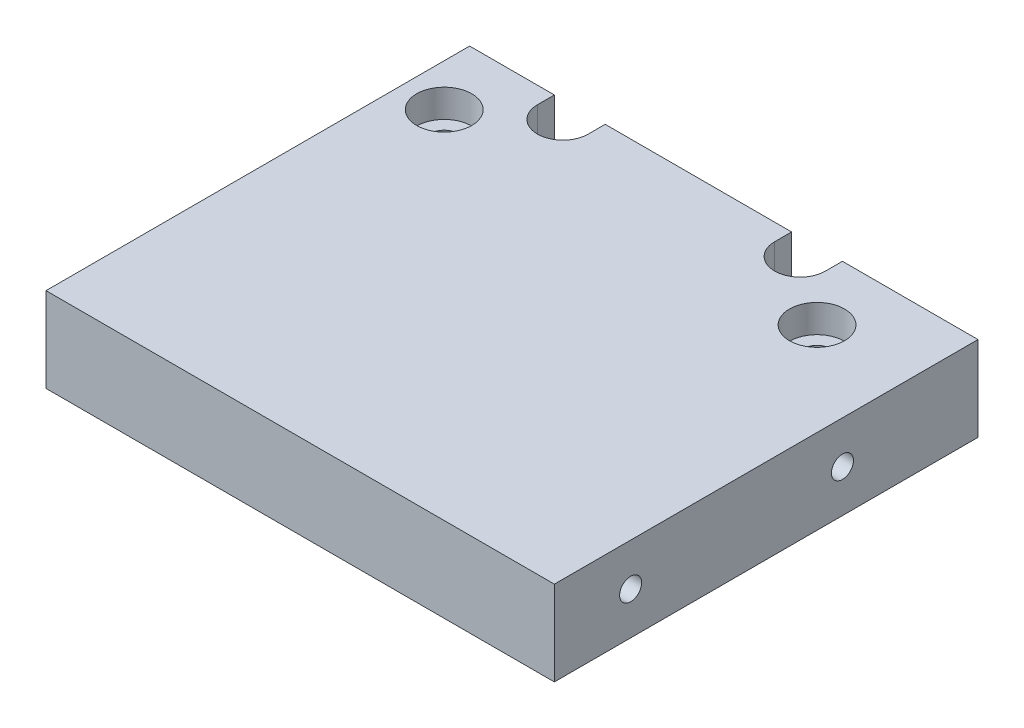
from build123d import *

# Parameters (mm, degrees)
SKETCH1_W                                = 60
SKETCH1_H                                = 50
BOSS_EXTRUDE1_DEPTH                      = 10
CUT_EXTRUDE1_DEPTH                       = 10
BOSS_EXTRUDE2_REACH                      = 80.74
CBORE_FOR_M3_PAN_HEAD_SCREW1_D           = 3.4
CBORE_FOR_M3_PAN_HEAD_SCREW1_CBORE_D     = 6.5
CBORE_FOR_M3_PAN_HEAD_SCREW1_CBORE_DEPTH = 3.3
M3X0_5_TAPPED_HOLE1_D                    = 2.6
M3X0_5_TAPPED_HOLE1_DEPTH                = 9
M3X0_5_TAPPED_HOLE1_TIP                  = 0.781118805
M3X0_5_TAPPED_HOLE2_D                    = 2.6
M3X0_5_TAPPED_HOLE2_DEPTH                = 9
M3X0_5_TAPPED_HOLE2_TIP                  = 0.781118805


with BuildPart() as part:
    # Sketch1 → Boss-Extrude1 (new body)
    with BuildSketch(Plane(origin=(0, 0, 0), x_dir=(1, 0, 0), z_dir=(0, 1, 0))):
        with Locations((30, 25)):
            Rectangle(SKETCH1_W, SKETCH1_H)
    extrude(amount=BOSS_EXTRUDE1_DEPTH)

    # Sketch2 → Cut-Extrude1 (cut)
    with BuildSketch(Plane(origin=(0, 10, 0), x_dir=(1, 0, 0), z_dir=(0, 1, 0))):
        with BuildLine():
            Line((38, 48), (38, 50))
            Line((38, 50), (44, 50))
            Line((44, 50), (44, 48))
            ThreePointArc((44, 48), (41, 45), (38, 48))
        make_face()
        with BuildLine():
            Line((10, 48), (10, 50))
            Line((10, 50), (16, 50))
            Line((16, 50), (16, 48))
            ThreePointArc((16, 48), (13, 45), (10, 48))
        make_face()
    extrude(amount=-CUT_EXTRUDE1_DEPTH, mode=Mode.SUBTRACT)

    # Sketch3 → Boss-Extrude2 (add, up to next)
    with BuildSketch(Plane(origin=(0, 0, 0), x_dir=(0, 0, -1), z_dir=(1, 0, 0)), mode=Mode.PRIVATE) as boss_extrude2_sk1:
        Polygon((45, 0), (50, 0), (50, 5), (45, 10), align=None)
    boss_extrude2_tool1 = extrude(boss_extrude2_sk1.sketch, amount=BOSS_EXTRUDE2_REACH, mode=Mode.PRIVATE) - part.part
    add(boss_extrude2_tool1.solids().sort_by_distance((0, 3.888889, -47.222222))[0])
    add(boss_extrude2_tool1.solids().sort_by_distance((0, 3.888889, -47.222222))[1])

    # CBORE for M3 Pan Head Screw1 (through all)
    with Locations(Plane(origin=(5, 10, -42), x_dir=(0, 0, 1), z_dir=(0, 1, 0))):
        with Locations((0, 0), (0, 44)):
            CounterBoreHole(CBORE_FOR_M3_PAN_HEAD_SCREW1_D / 2, CBORE_FOR_M3_PAN_HEAD_SCREW1_CBORE_D / 2, CBORE_FOR_M3_PAN_HEAD_SCREW1_CBORE_DEPTH)

    # M3x0.5 Tapped Hole1
    with Locations(Plane(origin=(60, 0, 0), x_dir=(0, 0, -1), z_dir=(1, 0, 0))):
        with Locations((34, 5), (9, 5)):
            Hole(M3X0_5_TAPPED_HOLE1_D / 2, depth=M3X0_5_TAPPED_HOLE1_DEPTH)
            with Locations((0, 0, -(M3X0_5_TAPPED_HOLE1_DEPTH + M3X0_5_TAPPED_HOLE1_TIP / 2))):  # 118° drill point
                Cone(0, M3X0_5_TAPPED_HOLE1_D / 2, M3X0_5_TAPPED_HOLE1_TIP, mode=Mode.SUBTRACT)

    # M3x0.5 Tapped Hole2
    with Locations(Plane.ZY):
        with Locations((-34, 5), (-9, 5)):
            Hole(M3X0_5_TAPPED_HOLE2_D / 2, depth=M3X0_5_TAPPED_HOLE2_DEPTH)
            with Locations((0, 0, -(M3X0_5_TAPPED_HOLE2_DEPTH + M3X0_5_TAPPED_HOLE2_TIP / 2))):  # 118° drill point
                Cone(0, M3X0_5_TAPPED_HOLE2_D / 2, M3X0_5_TAPPED_HOLE2_TIP, mode=Mode.SUBTRACT)


solid = part.part
